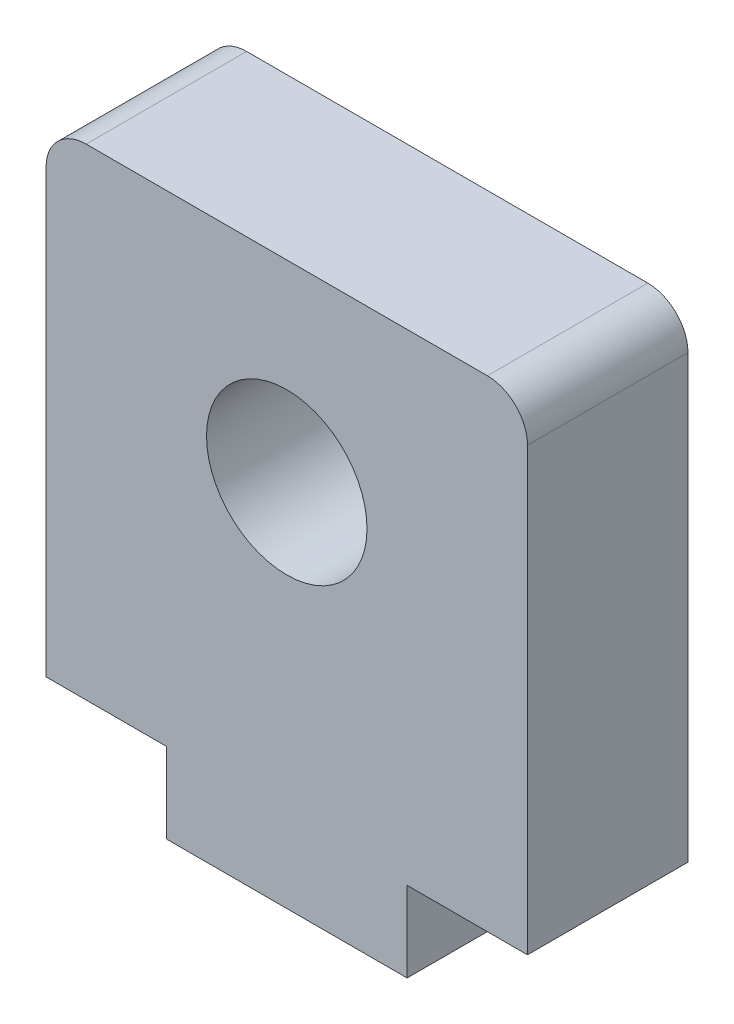
from build123d import *

# Parameters (mm, degrees)
SKETCH1_R           = 3.175
SKETCH1_W           = 9.525
SKETCH1_H           = 3.175
BOSS_EXTRUDE1_DEPTH = 6.35
FILLET1_R           = 1.5875


with BuildPart() as part:
    # Sketch1 → Boss-Extrude1 (new body)
    # profile 1 of 2: a face of its own
    with BuildSketch(Plane.XY):
        Polygon((9.525, 11.1125), (-9.525, 11.1125), (-9.525, -7.9375), (-4.7625, -7.9375), (4.7625, -7.9375), (9.525, -7.9375), align=None)
        with Locations((0, 3.4925)):
            Circle(SKETCH1_R, mode=Mode.SUBTRACT)
    # profile 2 of 2: a face of its own
    with BuildSketch(Plane.XY):
        with Locations((0, -9.525)):
            Rectangle(SKETCH1_W, SKETCH1_H)
    extrude(amount=BOSS_EXTRUDE1_DEPTH)

    # Fillet1
    fillet1_edges = [part.edges().sort_by_distance(p)[0] for p in [
        (-9.525, 11.1125, 3.175),
        (9.525, 11.1125, 3.175),
    ]]
    fillet(fillet1_edges, radius=FILLET1_R)


solid = part.part
